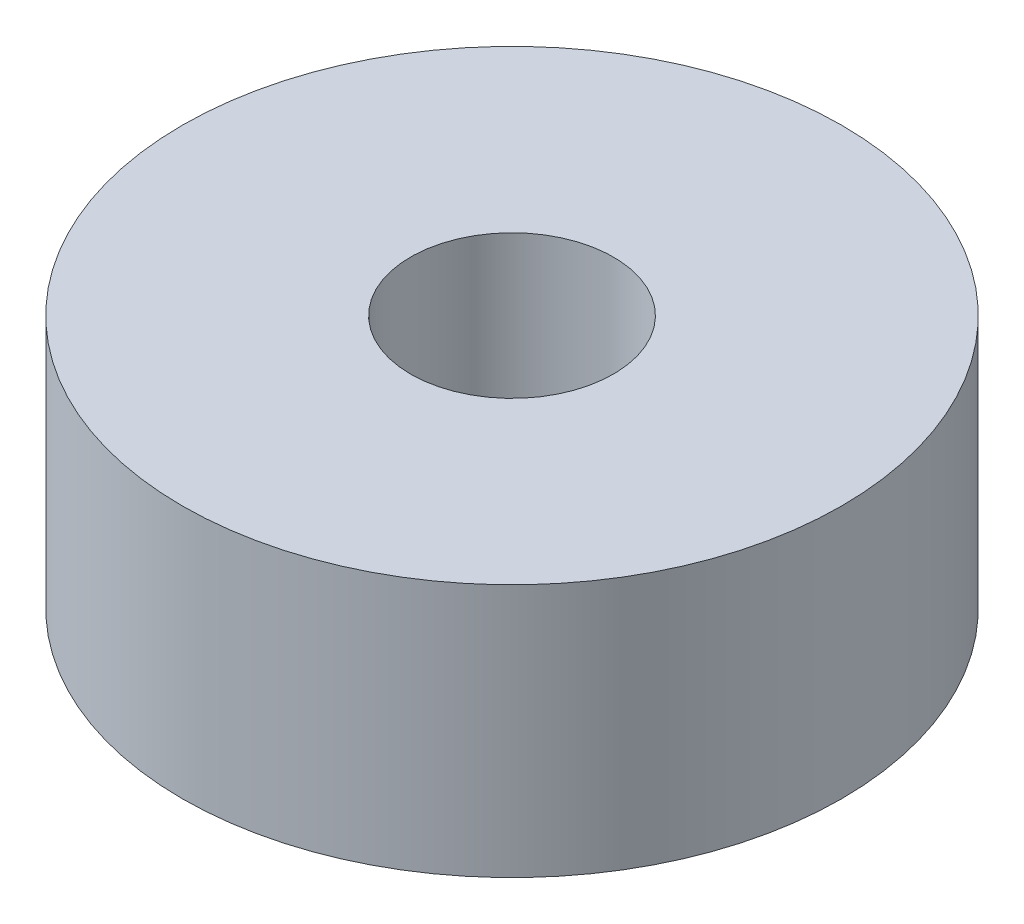
from build123d import *

# Parameters (mm, degrees)
ESQUISSE1_R        = 6.5
ESQUISSE1_R_2      = 2
BOSS_EXTRU_1_DEPTH = 5


with BuildPart() as part:
    # Esquisse1 → Boss.-Extru.1 (new body)
    with BuildSketch(Plane(origin=(0, 0, 0), x_dir=(1, 0, 0), z_dir=(0, 1, 0))):
        with Locations(Location((0, 0, 0), (0, 0, 270))):
            Circle(ESQUISSE1_R)
        with Locations(Location((0, 0, 0), (0, 0, 270))):
            Circle(ESQUISSE1_R_2, mode=Mode.SUBTRACT)
    extrude(amount=BOSS_EXTRU_1_DEPTH)


solid = part.part
